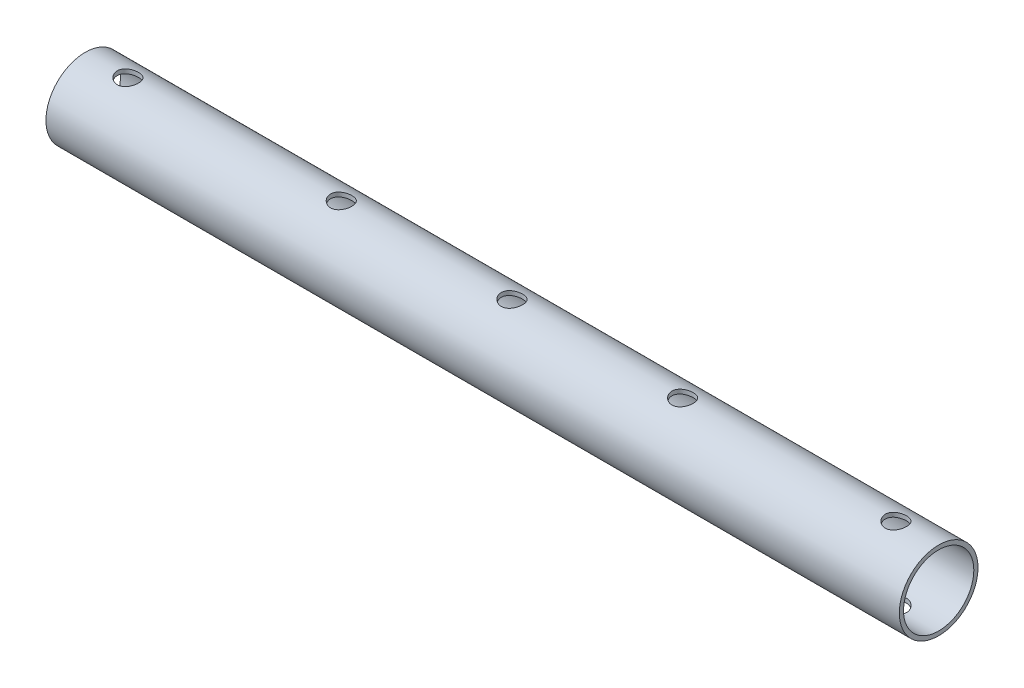
from build123d import *

# Parameters (mm, degrees)
SKETCH3_R               = 11.7094
SKETCH3_R_2             = 10.4648
BOSS_EXTRUDE1_DEPTH     = 254
CUT_EXTRUDE1_DEPTH      = 255.539230958
CUT_EXTRUDE1_DEPTH_BACK = 255.539230958
SKETCH4_R               = 3.175


with BuildPart() as part:
    # Sketch3 → Boss-Extrude1 (new body)
    with BuildSketch(Plane(origin=(0, 0, 0), x_dir=(0, 0, -1), z_dir=(1, 0, 0))):
        Circle(SKETCH3_R)
        Circle(SKETCH3_R_2, mode=Mode.SUBTRACT)
    extrude(amount=BOSS_EXTRUDE1_DEPTH)

    # Sketch4 → Cut-Extrude1 (cut, two sides: drawn at the far end of the back side and taken through both)
    with BuildSketch(Plane(origin=(0, 0, 0), x_dir=(1, 0, 0), z_dir=(0, 1, 0)).offset(-CUT_EXTRUDE1_DEPTH_BACK)):
        with Locations(Location((127, 0, 0), (0, 0, 90))):
            Circle(SKETCH4_R)
        with Locations(Location((12.7, 0, 0), (0, 0, 90))):
            Circle(SKETCH4_R)
        with Locations(Location((76.2, 0, 0), (0, 0, 90))):
            Circle(SKETCH4_R)
        with Locations(Location((177.8, 0, 0), (0, 0, 90))):
            Circle(SKETCH4_R)
        with Locations(Location((241.3, 0, 0), (0, 0, 90))):
            Circle(SKETCH4_R)
    extrude(amount=CUT_EXTRUDE1_DEPTH + CUT_EXTRUDE1_DEPTH_BACK, mode=Mode.SUBTRACT)


solid = part.part
